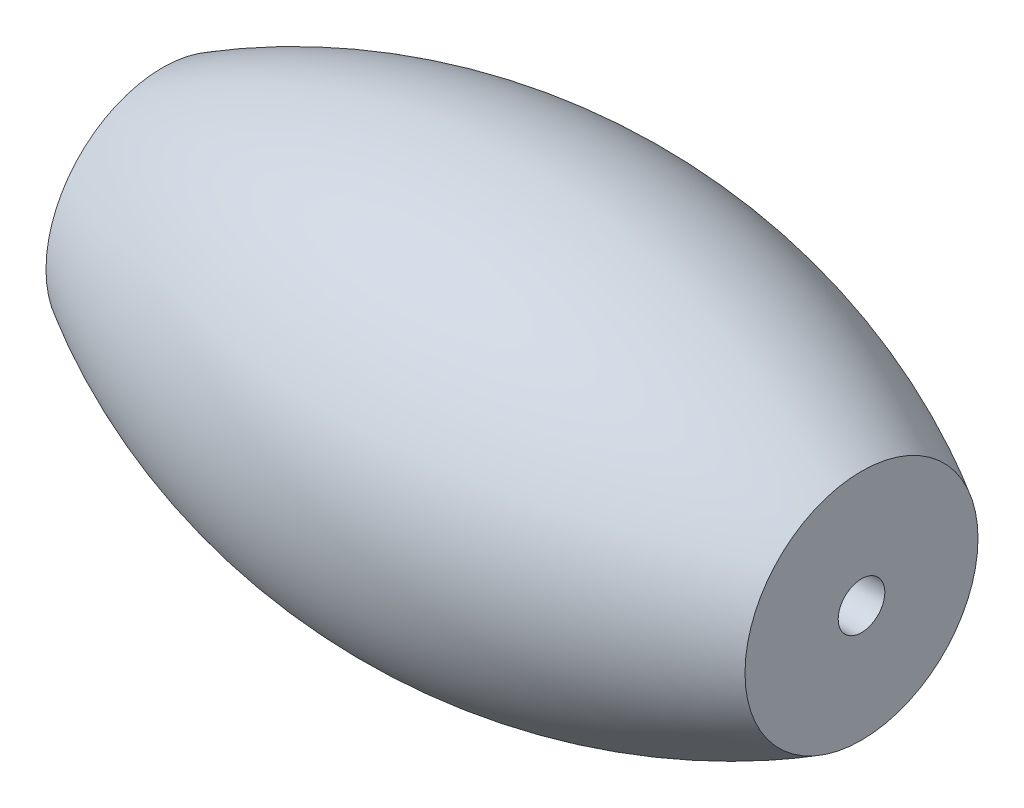
from build123d import *


with BuildPart() as part:
    # Sketch1 → Revolve3 (revolve)
    with BuildSketch(Plane(origin=(0, 0, 0), x_dir=(1, 0, 0), z_dir=(0, 1, 0)), mode=Mode.PRIVATE) as revolve3_sk:
        with BuildLine():
            Line((-15, 5), (-15, 1))
            Line((-15, 1), (15, 1))
            Line((15, 1), (15, 5))
            ThreePointArc((15, 5), (0, 9.019237886), (-15, 5))
        make_face()
    revolve(revolve3_sk.sketch.rotate(Axis((-15, 0, 0), (1, 0, 0)), 180), axis=Axis((-15, 0, 0), (1, 0, 0)))


solid = part.part
